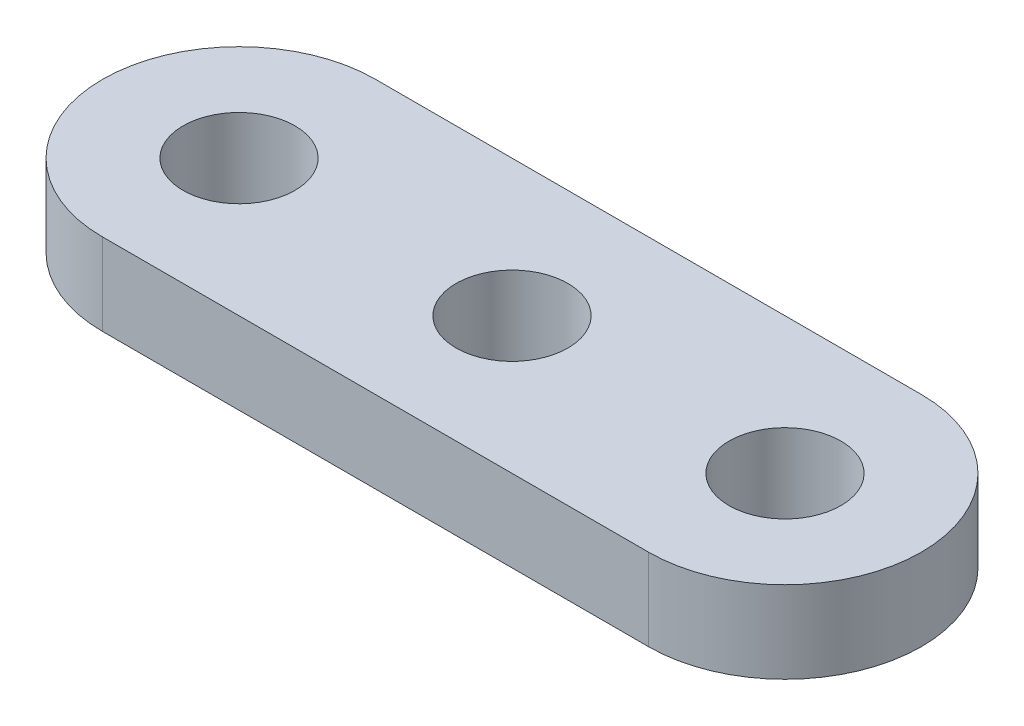
from build123d import *

# Parameters (mm, degrees)
SKETCH1_R           = 2.05
BOSS_EXTRUDE1_DEPTH = 1.5


with BuildPart() as part:
    # Sketch1 → Boss-Extrude1 (new, symmetric)
    with BuildSketch(Plane(origin=(0, 0, 0), x_dir=(1, 0, 0), z_dir=(0, 1, 0))):
        with BuildLine():
            Line((-10, 0), (-5, 0))
            Line((-5, 0), (5, 0))
            Line((5, 0), (10, 0))
            ThreePointArc((10, 0), (15, -5), (10, -10))
            Line((10, -10), (5, -10))
            Line((5, -10), (-5, -10))
            Line((-5, -10), (-10, -10))
            ThreePointArc((-10, -10), (-15, -5), (-10, 0))
        make_face()
        with Locations(Location((10, -5, 0), (0, 0, 270))):
            Circle(SKETCH1_R, mode=Mode.SUBTRACT)
        with Locations(Location((-10, -5, 0), (0, 0, 90))):
            Circle(SKETCH1_R, mode=Mode.SUBTRACT)
        with Locations(Location((0, -5, 0), (0, 0, 270))):
            Circle(SKETCH1_R, mode=Mode.SUBTRACT)
    extrude(amount=BOSS_EXTRUDE1_DEPTH, both=True)


solid = part.part
